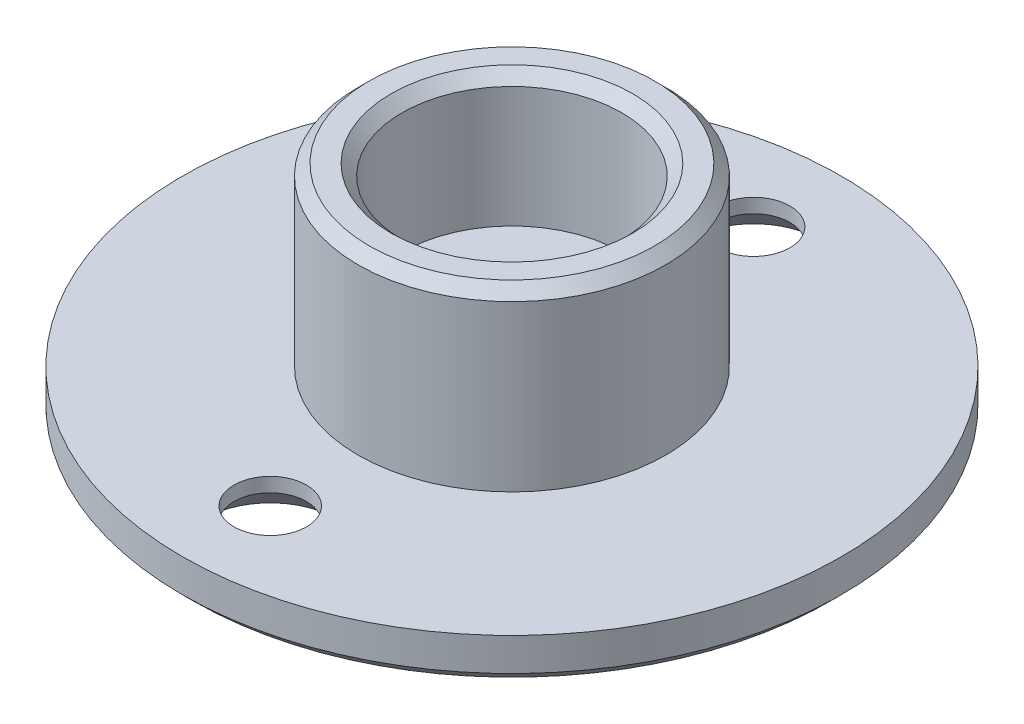
from build123d import *

# Parameters (mm, degrees)
SKETCH_1_R          = 15
EXTRUDE_1_DEPTH     = 2
SKETCH_2_R          = 7
EXTRUDE_2_DEPTH     = 8
SKETCH_3_R          = 5
CUT_EXTRUDE_1_DEPTH = 6
SKETCH_4_R          = 3
CUT_EXTRUDE_2_DEPTH = 23.045407685
CHAMFER_1_SIZE      = 0.5


with BuildPart() as part:
    # 草图1 → 凸台-拉伸1 (new body)
    with BuildSketch(Plane(origin=(0, 0, 0), x_dir=(1, 0, 0), z_dir=(0, 1, 0))):
        with Locations(Location((0, 0, 0), (0, 0, 270))):
            Circle(SKETCH_1_R)
    extrude(amount=EXTRUDE_1_DEPTH)

    # 草图2 → 凸台-拉伸2 (add)
    with BuildSketch(Plane(origin=(0, 2, 0), x_dir=(1, 0, 0), z_dir=(0, 1, 0))):
        with Locations(Location((0, 0, 0), (0, 0, 270))):
            Circle(SKETCH_2_R)
    extrude(amount=EXTRUDE_2_DEPTH)

    # 草图3 → 切除-拉伸1 (cut)
    with BuildSketch(Plane(origin=(0, 10, 0), x_dir=(1, 0, 0), z_dir=(0, 1, 0))):
        with Locations(Location((0, 0, 0), (0, 0, 270))):
            Circle(SKETCH_3_R)
    extrude(amount=-CUT_EXTRUDE_1_DEPTH, mode=Mode.SUBTRACT)

    # 草图4 → 切除-拉伸2 (cut, through all)
    with BuildSketch(Plane(origin=(0, 4, 0), x_dir=(1, 0, 0), z_dir=(0, 1, 0))):
        with Locations(Location((0, 0, 0), (0, 0, 270))):
            Circle(SKETCH_4_R)
    extrude(amount=-CUT_EXTRUDE_2_DEPTH, mode=Mode.SUBTRACT)

    # 倒角1
    chamfer_1_edges = [part.edges().sort_by_distance(p)[0] for p in [
        (0, 10, -5),
        (0, 0, -3),
        (0, 0, -15),
        (0, 10, -7),
    ]]
    chamfer(chamfer_1_edges, length=CHAMFER_1_SIZE)

    # 草图8 → M6 内六角花形半沉头螺钉的锥形沉头孔1 (revolve, cut)
    with BuildSketch(Plane(origin=(0, 0, 11), x_dir=(0, 0, -1), z_dir=(1, 0, 0))):
        Polygon((0, 0), (0, 3.65), (1.65, 2), (1.65, 1.35), (3, 0), align=None)
    hole_wizard_m6_1 = revolve(axis=Axis((0, -6.35, 11), (0, 1, 0)), mode=Mode.SUBTRACT)

    # 镜向1: M6 内六角花形半沉头螺钉的锥形沉头孔1 across plane
    add(hole_wizard_m6_1.mirror(Plane.XY), mode=Mode.SUBTRACT)


solid = part.part
